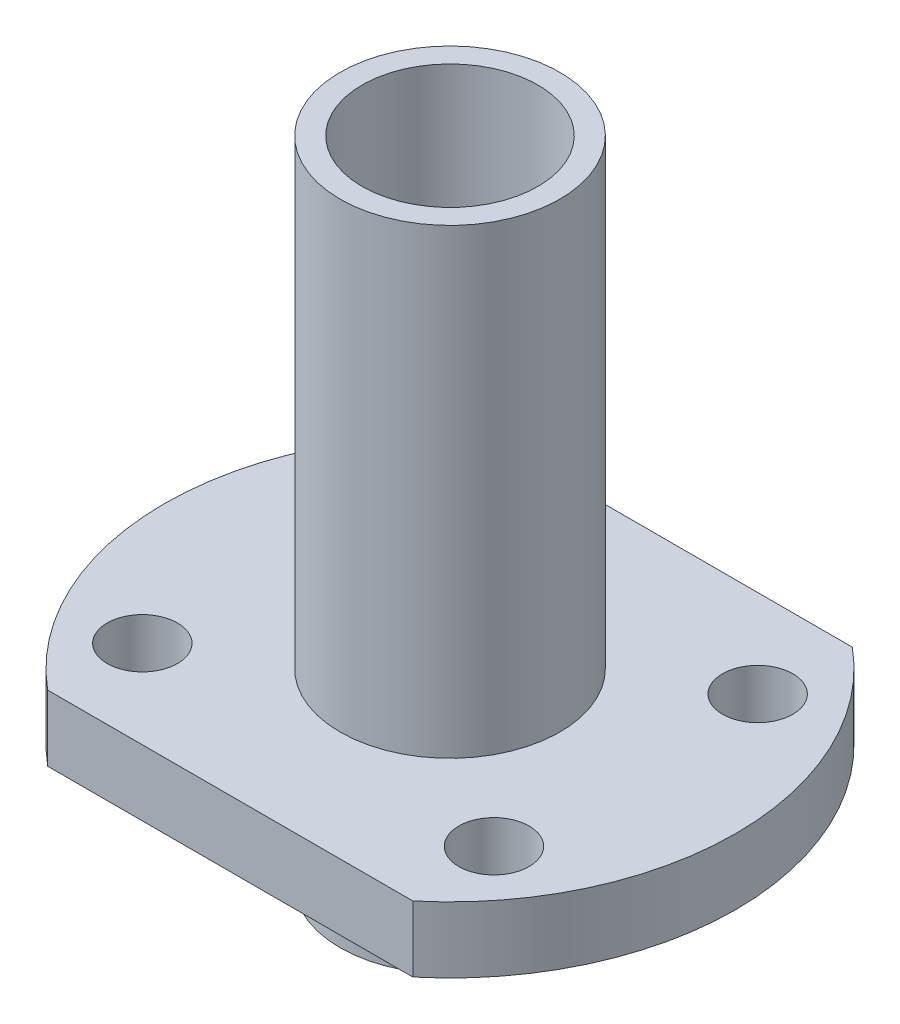
from build123d import *

# Parameters (mm, degrees)
SKETCH1_R                  = 5
BOSS_EXTRUDE1_DEPTH        = 29.5
BOSS_EXTRUDE2_DEPTH        = 3
SKETCH3_R                  = 4
CUT_EXTRUDE1_DEPTH         = 34.752777663
F_3_2_3_2_DIAMETER_HOLE1_D = 3.2


with BuildPart() as part:
    # Sketch1 → Boss-Extrude1 (new body)
    with BuildSketch(Plane(origin=(0, 0, 0), x_dir=(1, 0, 0), z_dir=(0, 1, 0))):
        with Locations(Location((0, 0, 0), (0, 0, 270))):
            Circle(SKETCH1_R)
    extrude(amount=BOSS_EXTRUDE1_DEPTH)

    # Sketch2 → Boss-Extrude2 (add)
    with BuildSketch(Plane(origin=(0, 5.5, 0), x_dir=(1, 0, 0), z_dir=(0, 1, 0))):
        with BuildLine():
            Line((8.306623863, 10), (-8.306623863, 10))
            ThreePointArc((-8.306623863, 10), (-11.768307238, 5.523309222), (-13, -2.7e-08))
            ThreePointArc((-13, -2.7e-08), (-11.768307226, -5.523309246), (-8.306623863, -10))
            Line((-8.306623863, -10), (8.306623863, -10))
            ThreePointArc((8.306623863, -10), (11.768307232, -5.523309234), (13, 0))
            ThreePointArc((13, 0), (11.768307232, 5.523309234), (8.306623863, 10))
        make_face()
    extrude(amount=BOSS_EXTRUDE2_DEPTH)

    # Sketch3 → Cut-Extrude1 (cut, through all)
    with BuildSketch(Plane(origin=(0, 29.5, 0), x_dir=(1, 0, 0), z_dir=(0, 1, 0))):
        with Locations(Location((0, 0, 0), (0, 0, 270))):
            Circle(SKETCH3_R)
    extrude(amount=-CUT_EXTRUDE1_DEPTH, mode=Mode.SUBTRACT)

    # Ø3.2 (3.2) Diameter Hole1 (through all)
    with Locations(Plane(origin=(8, 8.5, 6), x_dir=(0, 0, 1), z_dir=(0, 1, 0))):
        with Locations((0, 0), (-12, 0), (-12, -16), (0, -16)):
            Hole(F_3_2_3_2_DIAMETER_HOLE1_D / 2)


solid = part.part
